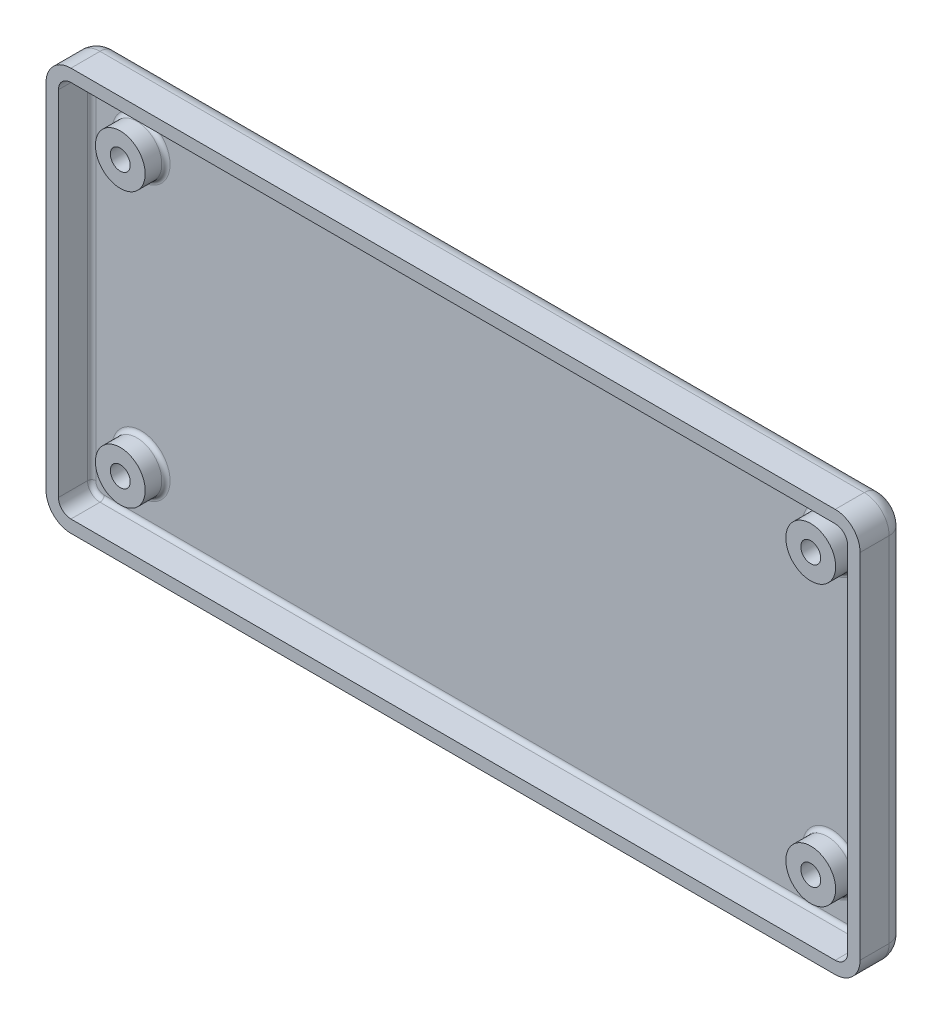
from build123d import *

# Parameters (mm, degrees)
SKETCH1_R                                        = 3
STANDOFFS_DEPTH                                  = 4
STANDOFFS_2_DEPTH                                = 4
STANDOFFS_3_DEPTH                                = 4
STANDOFFS_4_DEPTH                                = 4
SKETCH2_W                                        = 98.075
SKETCH2_H                                        = 48.545
BASE_DEPTH                                       = 1.5
SKETCH5_W                                        = 98.075
SKETCH5_H                                        = 48.545
SKETCH5_W_2                                      = 95.075
SKETCH5_H_2                                      = 45.545
WALL_DEPTH                                       = 4
FILLET1_R                                        = 3
FILLET2_R                                        = 1.5
FILLET3_R                                        = 2
FILLET4_R                                        = 0.5
CBORE_FOR_M2_PAN_HEAD_MACHINE_SCREW2_D           = 2.4
CBORE_FOR_M2_PAN_HEAD_MACHINE_SCREW2_CBORE_D     = 5
CBORE_FOR_M2_PAN_HEAD_MACHINE_SCREW2_CBORE_DEPTH = 1.6


with BuildPart() as part:
    # Sketch1 → Standoffs (new body)
    with BuildSketch(Plane(origin=(0, 0, 0), x_dir=(-1, 0, 0), z_dir=(0, 0, -1))):
        with Locations((-153.035, -93.345)):
            Circle(SKETCH1_R)
    extrude(amount=STANDOFFS_DEPTH)



with BuildPart() as body_2:
    # Sketch1 → Standoffs 2 (new body)
    with BuildSketch(Plane(origin=(0, 0, 0), x_dir=(-1, 0, 0), z_dir=(0, 0, -1))):
        with Locations((-153.035, -127)):
            Circle(SKETCH1_R)
    extrude(amount=STANDOFFS_2_DEPTH)


with BuildPart() as body_3:
    # Sketch1 → Standoffs 3 (new body)
    with BuildSketch(Plane(origin=(0, 0, 0), x_dir=(-1, 0, 0), z_dir=(0, 0, -1))):
        with Locations((-69.85, -127)):
            Circle(SKETCH1_R)
    extrude(amount=STANDOFFS_3_DEPTH)


with BuildPart() as body_4:
    # Sketch1 → Standoffs 4 (new body)
    with BuildSketch(Plane(origin=(0, 0, 0), x_dir=(-1, 0, 0), z_dir=(0, 0, -1))):
        with Locations((-69.85, -93.98)):
            Circle(SKETCH1_R)
    extrude(amount=STANDOFFS_4_DEPTH)


with BuildPart() as part_1:
    add(part.part)

    add(body_2.part)  # Base merges body 2

    add(body_3.part)  # Base merges body 3

    add(body_4.part)  # Base merges body 4
    # Sketch2 → Base (add)
    with BuildSketch(Plane(origin=(0, 0, -4), x_dir=(-1, 0, 0), z_dir=(0, 0, -1))):
        with Locations((-111.4425, -110.1725)):
            Rectangle(SKETCH2_W, SKETCH2_H)
    extrude(amount=-BASE_DEPTH)

    # Sketch5 → Wall (add)
    with BuildSketch(Plane.XY.offset(-2.5)):
        with Locations((111.4425, -110.1725)):
            Rectangle(SKETCH5_W, SKETCH5_H)
        with Locations((111.4425, -110.1725)):
            Rectangle(SKETCH5_W_2, SKETCH5_H_2, mode=Mode.SUBTRACT)
    extrude(amount=WALL_DEPTH)

    # Fillet1
    fillet1_edges = [part_1.edges().sort_by_distance(p)[0] for p in [
        (160.48, -134.445, -1.25),
        (160.48, -85.9, -1.25),
        (62.405, -85.9, -1.25),
        (62.405, -134.445, -1.25),
    ]]
    fillet(fillet1_edges, radius=FILLET1_R)

    # Fillet2
    fillet2_edges = [part_1.edges().sort_by_distance(p)[0] for p in [
        (158.98, -87.4, -0.5),
        (63.905, -87.4, -0.5),
        (63.905, -132.945, -0.5),
        (158.98, -132.945, -0.5),
    ]]
    fillet(fillet2_edges, radius=FILLET2_R)

    # Fillet3
    fillet3_edges = [part_1.edges().sort_by_distance(p)[0] for p in [
        (62.405, -110.1725, -4),
        (160.48, -110.1725, -4),
        (111.4425, -134.445, -4),
        (111.4425, -85.9, -4),
        (63.283679656, -133.566320344, -4),
        (159.601320344, -133.566320344, -4),
        (159.601320344, -86.778679656, -4),
        (63.283679656, -86.778679656, -4),
    ]]
    fillet(fillet3_edges, radius=FILLET3_R)

    # Fillet4
    fillet4_edges = [part_1.edges().sort_by_distance(p)[0] for p in [
        (156.035, -127, -2.5),
        (72.85, -127, -2.5),
        (72.85, -93.98, -2.5),
        (156.035, -93.345, -2.5),
        (158.98, -110.1725, -2.5),
        (111.4425, -132.945, -2.5),
        (111.4425, -87.4, -2.5),
        (63.905, -110.1725, -2.5),
        (64.344339828, -87.839339828, -2.5),
        (64.344339828, -132.505660172, -2.5),
        (158.540660172, -132.505660172, -2.5),
        (158.540660172, -87.839339828, -2.5),
    ]]
    fillet(fillet4_edges, radius=FILLET4_R)

    # CBORE for M2 Pan Head Machine Screw2 (through all)
    with Locations(Plane(origin=(0, 0, -4), x_dir=(-1, 0, 0), z_dir=(0, 0, -1))):
        with Locations((-69.85, -93.98), (-153.035, -93.345), (-153.035, -127), (-69.85, -127)):
            CounterBoreHole(CBORE_FOR_M2_PAN_HEAD_MACHINE_SCREW2_D / 2, CBORE_FOR_M2_PAN_HEAD_MACHINE_SCREW2_CBORE_D / 2, CBORE_FOR_M2_PAN_HEAD_MACHINE_SCREW2_CBORE_DEPTH)


solid = part_1.part
